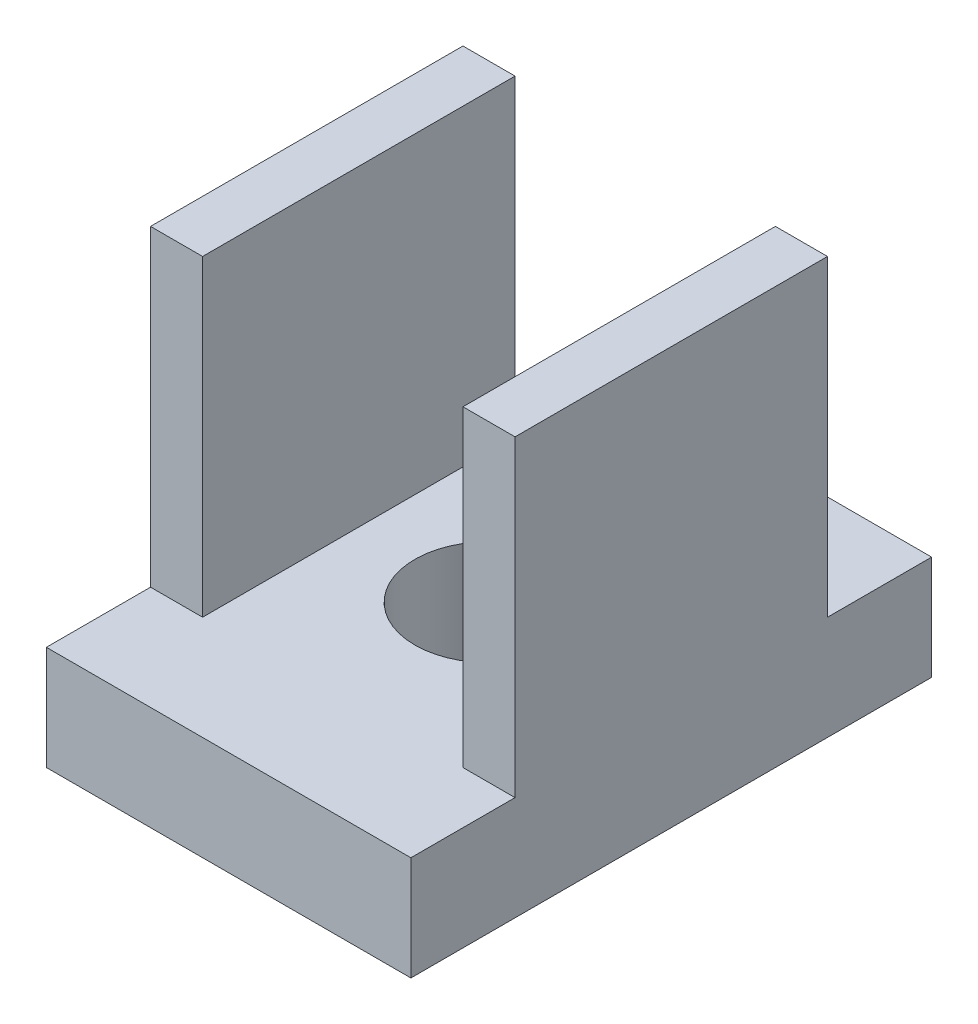
from build123d import *

# Parameters (mm, degrees)
SKETCH1_W           = 7
SKETCH1_H           = 10
BOSS_EXTRUDE1_DEPTH = 2
SKETCH2_R           = 1.425
CUT_EXTRUDE1_DEPTH  = 7.422616289
SKETCH3_W           = 1
SKETCH3_H           = 6
BOSS_EXTRUDE2_DEPTH = 6


with BuildPart() as part:
    # Sketch1 → Boss-Extrude1 (new body)
    with BuildSketch(Plane(origin=(0, 0, 0), x_dir=(1, 0, 0), z_dir=(0, 1, 0))):
        Rectangle(SKETCH1_W, SKETCH1_H)
    extrude(amount=BOSS_EXTRUDE1_DEPTH)

    # Sketch2 → Cut-Extrude1 (cut, through all)
    with BuildSketch(Plane(origin=(0, 2, 0), x_dir=(1, 0, 0), z_dir=(0, 1, 0))):
        with Locations(Location((0, 0, 0), (0, 0, 270))):
            Circle(SKETCH2_R)
    extrude(amount=-CUT_EXTRUDE1_DEPTH, mode=Mode.SUBTRACT)

    # Sketch3 → Boss-Extrude2 (add)
    with BuildSketch(Plane(origin=(0, 2, 0), x_dir=(1, 0, 0), z_dir=(0, 1, 0))):
        with Locations((3, 0)):
            Rectangle(SKETCH3_W, SKETCH3_H)
        with Locations((-3, 0)):
            Rectangle(SKETCH3_W, SKETCH3_H)
    extrude(amount=BOSS_EXTRUDE2_DEPTH)


solid = part.part
